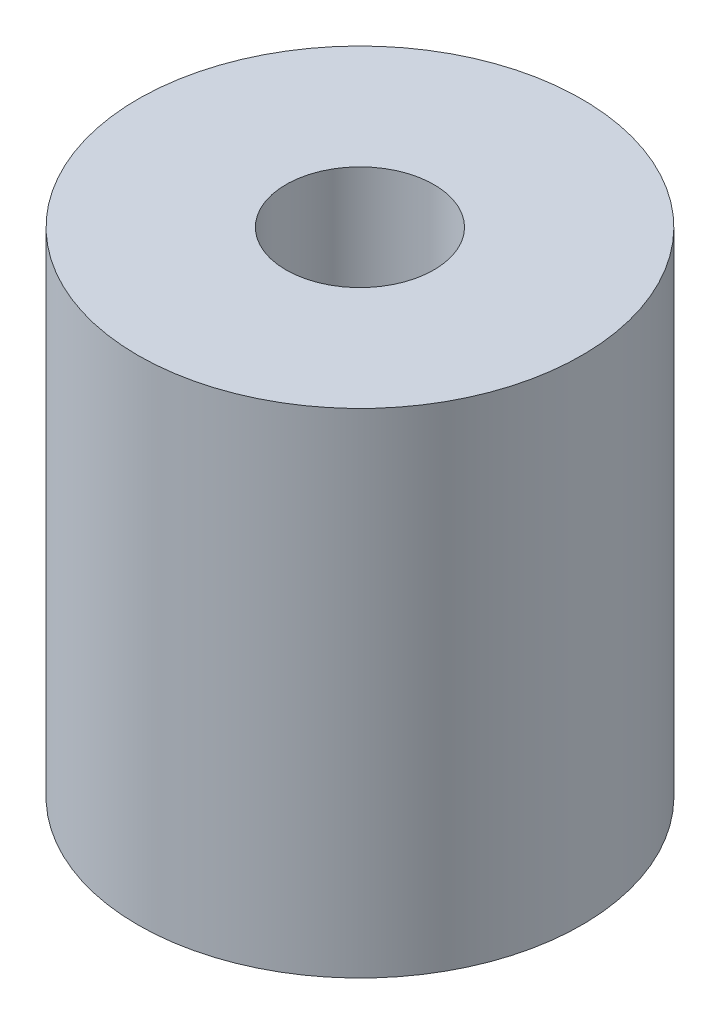
from build123d import *

# Parameters (mm, degrees)
SKETCH1_R           = 4.5
SKETCH1_R_2         = 1.5
BOSS_EXTRUDE1_DEPTH = 10


with BuildPart() as part:
    # Sketch1 → Boss-Extrude1 (new body)
    with BuildSketch(Plane(origin=(0, 0, 0), x_dir=(1, 0, 0), z_dir=(0, 1, 0))):
        with Locations(Location((0, 0, 0), (0, 0, 270))):
            Circle(SKETCH1_R)
        with Locations(Location((0, 0, 0), (0, 0, 270))):
            Circle(SKETCH1_R_2, mode=Mode.SUBTRACT)
    extrude(amount=BOSS_EXTRUDE1_DEPTH)


solid = part.part
